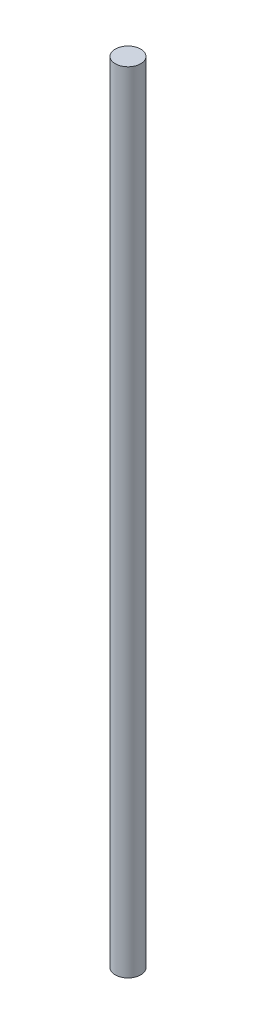
from build123d import *

# Parameters (mm, degrees)
SKETCH1_R           = 3.175
BOSS_EXTRUDE1_DEPTH = 196.85


with BuildPart() as part:
    # Sketch1 → Boss-Extrude1 (new body)
    with BuildSketch(Plane(origin=(0, 0, 0), x_dir=(1, 0, 0), z_dir=(0, 1, 0))):
        with Locations(Location((0, 0, 0), (0, 0, 270))):
            Circle(SKETCH1_R)
    extrude(amount=BOSS_EXTRUDE1_DEPTH)


solid = part.part
